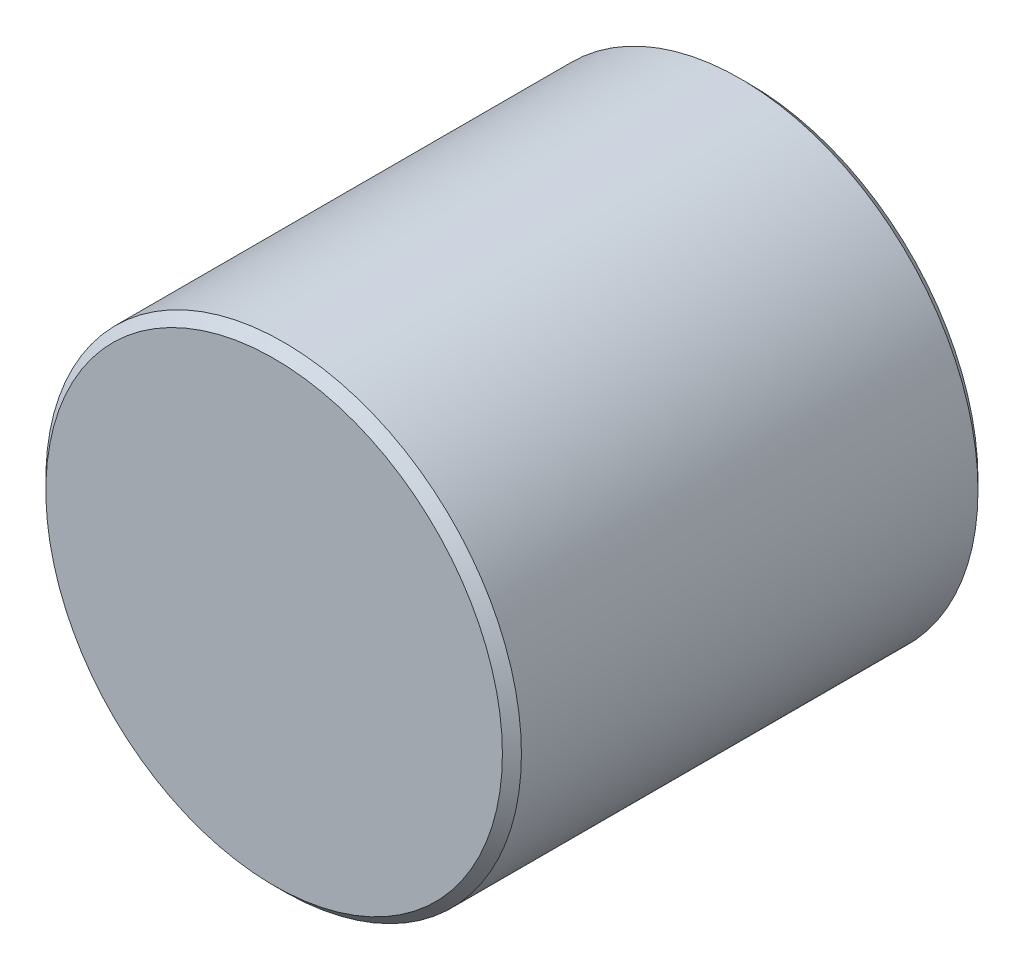
from build123d import *

# Parameters (mm, degrees)
SKETCH1_R           = 2.5
BOSS_EXTRUDE1_DEPTH = 5
CHAMFER1_SIZE       = 0.1


with BuildPart() as part:
    # Sketch1 → Boss-Extrude1 (new body)
    with BuildSketch(Plane.XY):
        Circle(SKETCH1_R)
    extrude(amount=BOSS_EXTRUDE1_DEPTH)

    # Chamfer1
    chamfer1_edges = [part.edges().sort_by_distance(p)[0] for p in [
        (-2.5, 0, 0),
        (-2.5, 0, 5),
    ]]
    chamfer(chamfer1_edges, length=CHAMFER1_SIZE)


solid = part.part
